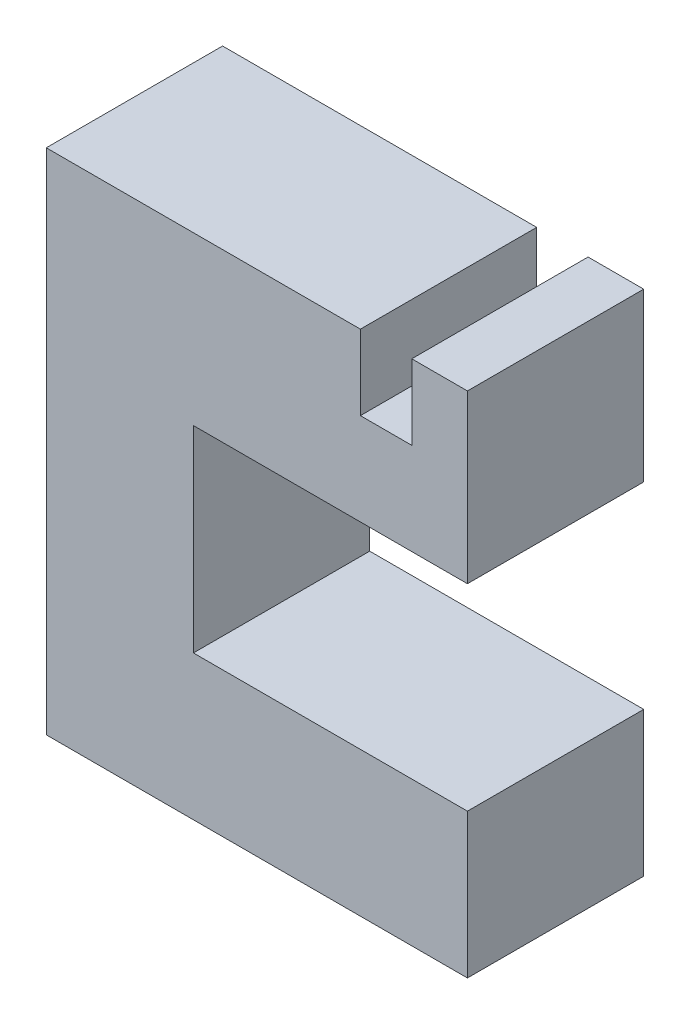
from build123d import *

# Parameters (mm, degrees)
BOSS_EXTRU_1_DEPTH = 20


with BuildPart() as part:
    # Esquisse1 → Boss.-Extru.1 (new body)
    with BuildSketch(Plane.XY):
        Polygon((47.777011134, 57.678571429), (47.777011134, 38.735714286), (16.691296848, 38.735714286), (16.691296848, 16.392857143), (47.777011134, 16.392857143), (47.777011134, 0), (0, 0), (0, 57.678571429), (35.634153991, 57.678571429), (35.634153991, 49.178571429), (41.462725419, 49.178571429), (41.462725419, 57.678571429), align=None)
    extrude(amount=BOSS_EXTRU_1_DEPTH)


solid = part.part
